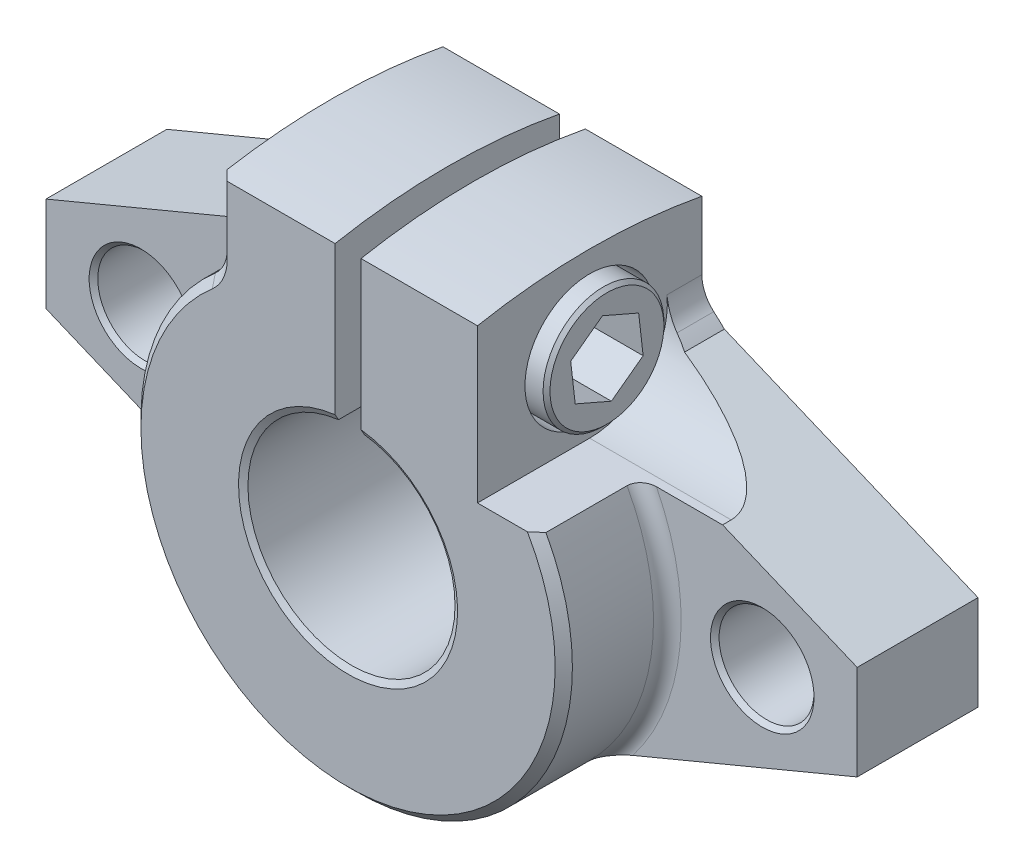
from build123d import *

# Parameters (mm, degrees)
BOSS_EXTRUDE1_DEPTH                                 = 13
CUT_EXTRUDE1_DEPTH                                  = 24.780243901
CUT_EXTRUDE1_DEPTH_BACK                             = 24.780243901
FILLET1_R                                           = 2
BOSS_EXTRUDE2_DEPTH                                 = 7
F_5_5_5_5_DIAMETER_HOLE1_D                          = 5.5
F_5_5_5_5_DIAMETER_HOLE1_DEPTH                      = 10
F_5_5_5_5_DIAMETER_HOLE1_CSINK_D                    = 6
F_5_5_5_5_DIAMETER_HOLE1_CSINK_ANGLE                = 90
F_5_5_5_5_DIAMETER_HOLE1_TIP                        = 1.652366702
CUT_EXTRUDE2_REACH                                  = 39.017
CBORE_FOR_M4_HEX_SOCKET_HEAD_CAP_SCREW3_D           = 3.4
CBORE_FOR_M4_HEX_SOCKET_HEAD_CAP_SCREW3_CBORE_D     = 7.5
CBORE_FOR_M4_HEX_SOCKET_HEAD_CAP_SCREW3_CBORE_DEPTH = 3
CHAMFER1_SIZE                                       = 0.2
CUT_EXTRUDE3_DEPTH                                  = 3
CHAMFER2_SIZE                                       = 0.5
FILLET2_R                                           = 0.8
CHAMFER3_SIZE                                       = 0.2
CHAMFER3_SIZE2                                      = 0.346410162


with BuildPart() as part:
    # Sketch1 → Boss-Extrude1 (new body)
    with BuildSketch(Plane.XY):
        with BuildLine():
            Line((0.75, 5.95294045), (0.75, 15.5))
            Line((0.75, 15.5), (7.5, 15.5))
            Line((7.5, 15.5), (7.5, 10))
            ThreePointArc((7.5, 10), (0, -12.5), (-7.5, 10))
            Line((-7.5, 10), (-7.5, 15.5))
            Line((-7.5, 15.5), (-0.75, 15.5))
            Line((-0.75, 15.5), (-0.75, 5.95294045))
            ThreePointArc((-0.75, 5.95294045), (0, -6), (0.75, 5.95294045))
        make_face()
    extrude(amount=BOSS_EXTRUDE1_DEPTH)

    # Sketch2 → Cut-Extrude1 (cut, two sides: drawn at the far end of the back side and taken through both)
    with BuildSketch(Plane(origin=(0, 0, 0), x_dir=(0, 0, -1), z_dir=(1, 0, 0)).offset(-CUT_EXTRUDE1_DEPTH_BACK)):
        with BuildLine():
            Line((69.410215856, 1.772448509), (0, 14.891132578))
            ThreePointArc((0, 14.891132578), (-6.5, 15.5), (-13, 14.891132578))
            Line((-13, 14.891132578), (-82.410215856, 1.772448509))
            Line((-82.410215856, 1.772448509), (-82.410215856, 143.050584636))
            Line((-82.410215856, 143.050584636), (69.410215856, 143.050584636))
            Line((69.410215856, 143.050584636), (69.410215856, 1.772448509))
        make_face()
    extrude(amount=CUT_EXTRUDE1_DEPTH + CUT_EXTRUDE1_DEPTH_BACK, mode=Mode.SUBTRACT)

    # Fillet1
    fillet1_edges = [part.edges().sort_by_distance(p)[0] for p in [
        (7.5, 10, 6.5),
        (-7.5, 10, 6.5),
    ]]
    fillet(fillet1_edges, radius=FILLET1_R)

    # Sketch3 → Boss-Extrude2 (add)
    with BuildSketch(Plane.XY):
        with BuildLine():
            Line((8.803538255, 8.873990883), (23.5, 2.75))
            Line((23.5, 2.75), (23.5, -2.75))
            Line((23.5, -2.75), (8.803538255, -8.873990883))
            ThreePointArc((8.803538255, -8.873990883), (12.5, 0), (8.803538255, 8.873990883))
        make_face()
    extrude(amount=BOSS_EXTRUDE2_DEPTH)

    # Mirror1: part across plane


with BuildPart() as part_1:
    add(part.part)
    add(part.part.mirror(Plane(origin=(0, 0, 0), x_dir=(0, 0, 1), z_dir=(1, 0, 0))))

    # Ø5.5 (5.5) Diameter Hole1
    with Locations(Plane.XY.offset(7)):
        with Locations((18, 0), (-18, 0)):
            CounterSinkHole(F_5_5_5_5_DIAMETER_HOLE1_D / 2, F_5_5_5_5_DIAMETER_HOLE1_CSINK_D / 2, depth=F_5_5_5_5_DIAMETER_HOLE1_DEPTH, counter_sink_angle=F_5_5_5_5_DIAMETER_HOLE1_CSINK_ANGLE)
            with Locations((0, 0, -(F_5_5_5_5_DIAMETER_HOLE1_DEPTH + F_5_5_5_5_DIAMETER_HOLE1_TIP / 2))):  # 118° drill point
                Cone(0, F_5_5_5_5_DIAMETER_HOLE1_D / 2, F_5_5_5_5_DIAMETER_HOLE1_TIP, mode=Mode.SUBTRACT)

    # Sketch9 → Cut-Extrude2 (cut, up to next)
    with BuildSketch(Plane(origin=(7.5, 0, 0), x_dir=(0, 0, -1), z_dir=(1, 0, 0)), mode=Mode.PRIVATE) as cut_extrude2_sk1:
        with BuildLine():
            Line((-2.023006126, 10.95445115), (-13, 10.95445115))
            Line((-13, 10.95445115), (-13, 6))
            Line((-13, 6), (-6.5, 6))
            ThreePointArc((-6.5, 6), (-3.161210536, 7.482967532), (-2.023006126, 10.95445115))
        make_face()
    cut_extrude2_tool1 = extrude(cut_extrude2_sk1.sketch, amount=CUT_EXTRUDE2_REACH, mode=Mode.PRIVATE) & part_1.part
    add(cut_extrude2_tool1.solids().sort_by_distance((7.5, 8.604622, 7.889878))[0], mode=Mode.SUBTRACT)

    # CBORE for M4 Hex Socket Head Cap Screw3 (through all)
    with Locations(Plane(origin=(7.5, 0, 0), x_dir=(0, 0, -1), z_dir=(1, 0, 0))):
        with Locations((-6.5, 10.5)):
            CounterBoreHole(CBORE_FOR_M4_HEX_SOCKET_HEAD_CAP_SCREW3_D / 2, CBORE_FOR_M4_HEX_SOCKET_HEAD_CAP_SCREW3_CBORE_D / 2, CBORE_FOR_M4_HEX_SOCKET_HEAD_CAP_SCREW3_CBORE_DEPTH)

    # Sketch12 → Revolve1 (revolve)
    with BuildSketch(Plane.XY.offset(6.5), mode=Mode.PRIVATE) as revolve1_sk:
        Polygon((4.5, 14), (8.5, 14), (8.5, 10.5), (-5.5, 10.5), (-5.5, 12), (-5, 12.5), (4.5, 12.5), align=None)
    revolve(revolve1_sk.sketch.rotate(Axis((0, 10.5, 6.5), (1, 0, 0)), 270), axis=Axis((0, 10.5, 6.5), (1, 0, 0)))

    # Chamfer1
    chamfer1_edges = [part_1.edges().sort_by_distance(p)[0] for p in [
        (8.5, 10.5, 10),
    ]]
    chamfer(chamfer1_edges, length=CHAMFER1_SIZE)

    # Sketch13 → Cut-Extrude3 (cut)
    with BuildSketch(Plane(origin=(8.5, 0, 0), x_dir=(0, 0, -1), z_dir=(1, 0, 0))):
        Polygon((-4.661489956, 11.861177424), (-6.759559206, 12.772785116), (-8.598069251, 11.411607691), (-8.338510044, 9.138822576), (-6.240440794, 8.227214884), (-4.401930749, 9.588392309), align=None)
    extrude(amount=-CUT_EXTRUDE3_DEPTH, mode=Mode.SUBTRACT)

    # Chamfer2
    chamfer2_edges = [part_1.edges().sort_by_distance(p)[0] for p in [
        (-7.5, 12.922791864, 13),
        (-2.211613172, -12.302795096, 13),
        (-7.680564695, 10.123996352, 13),
    ]]
    chamfer(chamfer2_edges, length=CHAMFER2_SIZE)

    # Fillet2
    fillet2_edges = [part_1.edges().sort_by_distance(p)[0] for p in [
        (12.36996926, -1.798293779, 7),
        (8.803538255, -8.873990883, 3.5),
        (-12.5, 0, 7),
        (-8.803538255, -8.873990883, 3.5),
    ]]
    fillet(fillet2_edges, radius=FILLET2_R)

    # Chamfer3
    chamfer3_edges = [part_1.edges().sort_by_distance(p)[0] for p in [
        (0, -6, 13),
    ]]
    chamfer3_side = [part_1.faces().sort_by_distance(p)[0] for p in [
        (0, -6, 6.5),
    ]]
    chamfer(chamfer3_edges, length=CHAMFER3_SIZE, length2=CHAMFER3_SIZE2, reference=chamfer3_side[0])


solid = part_1.part
